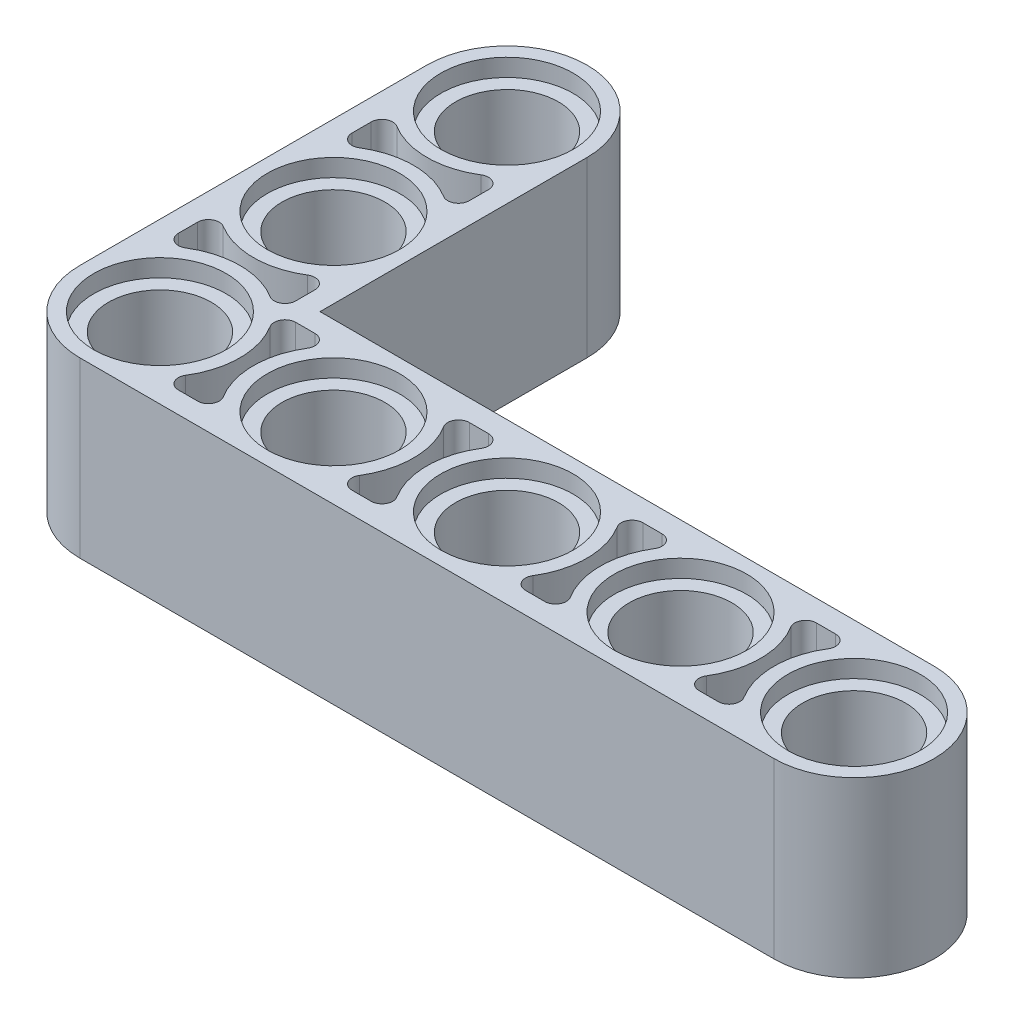
from build123d import *

# Parameters (mm, degrees)
BOSS_EXTRUDE1_DEPTH = 8.065
CUT_EXTRUDE1_DEPTH  = 3
CUT_EXTRUDE2_DEPTH  = 3
CUT_EXTRUDE3_DEPTH  = 3
CUT_EXTRUDE4_DEPTH  = 3
CUT_EXTRUDE5_DEPTH  = 3
CUT_EXTRUDE6_DEPTH  = 3
CUT_EXTRUDE7_START  = -3
CUT_EXTRUDE7_DEPTH  = 3
CUT_EXTRUDE8_START  = -3
CUT_EXTRUDE8_DEPTH  = 3
CUT_EXTRUDE9_START  = -3
CUT_EXTRUDE9_DEPTH  = 3
CUT_EXTRUDE10_START = -3
CUT_EXTRUDE10_DEPTH = 3
CUT_EXTRUDE11_START = -3
CUT_EXTRUDE11_DEPTH = 3
CUT_EXTRUDE12_START = -3
CUT_EXTRUDE12_DEPTH = 3
FILLET1_R           = 3.72


with BuildPart() as part:
    # Sketch1 → Boss-Extrude1 (new body)
    with BuildSketch(Plane(origin=(0, 4.0325, 0), x_dir=(1, 0, 0), z_dir=(0, 1, 0))):
        with BuildLine():
            Line((0, 3.72), (-28.54, 3.72))
            Line((-28.54, 3.72), (-28.54, 16.13))
            ThreePointArc((-28.54, 16.13), (-32.26, 19.85), (-35.98, 16.13))
            Line((-35.98, 16.13), (-35.98, -3.72))
            Line((-35.98, -3.72), (0, -3.72))
            ThreePointArc((0, -3.72), (3.72, 0), (0, 3.72))
        make_face()
    extrude(amount=-BOSS_EXTRUDE1_DEPTH)

    # Sketch2 → Cut-Extrude1 (cut)
    with BuildSketch(Plane(origin=(0, 4.0325, 0), x_dir=(-1, 0, 0), z_dir=(0, 1, 0))):
        with BuildLine():
            Line((3.5855, -2.725441473), (4.4795, -2.725441473))
            ThreePointArc((4.4795, -2.725441473), (4.916443331, -2.468506331), (4.904322275, -1.961763573))
            ThreePointArc((4.904322275, -1.961763573), (4.345, 0), (4.904322275, 1.961763573))
            ThreePointArc((4.904322275, 1.961763573), (4.916443331, 2.468506331), (4.4795, 2.725441473))
            Line((4.4795, 2.725441473), (3.5855, 2.725441473))
            ThreePointArc((3.5855, 2.725441473), (3.148556669, 2.468506331), (3.160677725, 1.961763573))
            ThreePointArc((3.160677725, 1.961763573), (3.72, 0), (3.160677725, -1.961763573))
            ThreePointArc((3.160677725, -1.961763573), (3.148556669, -2.468506331), (3.5855, -2.725441473))
        make_face()
    extrude(amount=-CUT_EXTRUDE1_DEPTH, mode=Mode.SUBTRACT)

    # Sketch3 → Cut-Extrude2 (cut)
    with BuildSketch(Plane(origin=(0, 4.0325, 0), x_dir=(-1, 0, 0), z_dir=(0, 1, 0))):
        with BuildLine():
            Line((11.6505, -2.725441473), (12.5445, -2.725441473))
            ThreePointArc((12.5445, -2.725441473), (12.981443331, -2.468506331), (12.969322275, -1.961763573))
            ThreePointArc((12.969322275, -1.961763573), (12.41, 0), (12.969322275, 1.961763573))
            ThreePointArc((12.969322275, 1.961763573), (12.981443331, 2.468506331), (12.5445, 2.725441473))
            Line((12.5445, 2.725441473), (11.6505, 2.725441473))
            ThreePointArc((11.6505, 2.725441473), (11.213556669, 2.468506331), (11.225677725, 1.961763573))
            ThreePointArc((11.225677725, 1.961763573), (11.785, 0), (11.225677725, -1.961763573))
            ThreePointArc((11.225677725, -1.961763573), (11.213556669, -2.468506331), (11.6505, -2.725441473))
        make_face()
    extrude(amount=-CUT_EXTRUDE2_DEPTH, mode=Mode.SUBTRACT)

    # Sketch4 → Cut-Extrude3 (cut)
    with BuildSketch(Plane(origin=(0, 4.0325, 0), x_dir=(-1, 0, 0), z_dir=(0, 1, 0))):
        with BuildLine():
            Line((19.7155, -2.725441473), (20.6095, -2.725441473))
            ThreePointArc((20.6095, -2.725441473), (21.046443331, -2.468506331), (21.034322275, -1.961763573))
            ThreePointArc((21.034322275, -1.961763573), (20.475, 0), (21.034322275, 1.961763573))
            ThreePointArc((21.034322275, 1.961763573), (21.046443331, 2.468506331), (20.6095, 2.725441473))
            Line((20.6095, 2.725441473), (19.7155, 2.725441473))
            ThreePointArc((19.7155, 2.725441473), (19.278556669, 2.468506331), (19.290677725, 1.961763573))
            ThreePointArc((19.290677725, 1.961763573), (19.85, 0), (19.290677725, -1.961763573))
            ThreePointArc((19.290677725, -1.961763573), (19.278556669, -2.468506331), (19.7155, -2.725441473))
        make_face()
    extrude(amount=-CUT_EXTRUDE3_DEPTH, mode=Mode.SUBTRACT)

    # Sketch5 → Cut-Extrude4 (cut)
    with BuildSketch(Plane(origin=(0, 4.0325, 0), x_dir=(-1, 0, 0), z_dir=(0, 1, 0))):
        with BuildLine():
            Line((27.7805, -2.725441473), (28.6745, -2.725441473))
            ThreePointArc((28.6745, -2.725441473), (29.111443331, -2.468506331), (29.099322275, -1.961763573))
            ThreePointArc((29.099322275, -1.961763573), (28.54, 0), (29.099322275, 1.961763573))
            ThreePointArc((29.099322275, 1.961763573), (29.111443331, 2.468506331), (28.6745, 2.725441473))
            Line((28.6745, 2.725441473), (27.7805, 2.725441473))
            ThreePointArc((27.7805, 2.725441473), (27.343556669, 2.468506331), (27.355677725, 1.961763573))
            ThreePointArc((27.355677725, 1.961763573), (27.915, 0), (27.355677725, -1.961763573))
            ThreePointArc((27.355677725, -1.961763573), (27.343556669, -2.468506331), (27.7805, -2.725441473))
        make_face()
    extrude(amount=-CUT_EXTRUDE4_DEPTH, mode=Mode.SUBTRACT)

    # Sketch6 → Cut-Extrude5 (cut)
    with BuildSketch(Plane(origin=(0, 4.0325, 0), x_dir=(-1, 0, 0), z_dir=(0, 1, 0))):
        with BuildLine():
            Line((29.534558527, -3.5855), (29.534558527, -4.4795))
            ThreePointArc((29.534558527, -4.4795), (29.791493669, -4.916443331), (30.298236427, -4.904322275))
            ThreePointArc((30.298236427, -4.904322275), (32.26, -4.345), (34.221763573, -4.904322275))
            ThreePointArc((34.221763573, -4.904322275), (34.728506331, -4.916443331), (34.985441473, -4.4795))
            Line((34.985441473, -4.4795), (34.985441473, -3.5855))
            ThreePointArc((34.985441473, -3.5855), (34.728506331, -3.148556669), (34.221763573, -3.160677725))
            ThreePointArc((34.221763573, -3.160677725), (32.26, -3.72), (30.298236427, -3.160677725))
            ThreePointArc((30.298236427, -3.160677725), (29.791493669, -3.148556669), (29.534558527, -3.5855))
        make_face()
    extrude(amount=-CUT_EXTRUDE5_DEPTH, mode=Mode.SUBTRACT)

    # Sketch7 → Cut-Extrude6 (cut)
    with BuildSketch(Plane(origin=(0, 4.0325, 0), x_dir=(-1, 0, 0), z_dir=(0, 1, 0))):
        with BuildLine():
            Line((29.534558527, -11.6505), (29.534558527, -12.5445))
            ThreePointArc((29.534558527, -12.5445), (29.791493669, -12.981443331), (30.298236427, -12.969322275))
            ThreePointArc((30.298236427, -12.969322275), (32.26, -12.41), (34.221763573, -12.969322275))
            ThreePointArc((34.221763573, -12.969322275), (34.728506331, -12.981443331), (34.985441473, -12.5445))
            Line((34.985441473, -12.5445), (34.985441473, -11.6505))
            ThreePointArc((34.985441473, -11.6505), (34.728506331, -11.213556669), (34.221763573, -11.225677725))
            ThreePointArc((34.221763573, -11.225677725), (32.26, -11.785), (30.298236427, -11.225677725))
            ThreePointArc((30.298236427, -11.225677725), (29.791493669, -11.213556669), (29.534558527, -11.6505))
        make_face()
    extrude(amount=-CUT_EXTRUDE6_DEPTH, mode=Mode.SUBTRACT)

    # Sketch8 → Cut-Extrude7 (cut)
    with BuildSketch(Plane.XZ.offset(4.0325).offset(CUT_EXTRUDE7_START)):
        with BuildLine():
            Line((-4.4795, -2.725441473), (-3.5855, -2.725441473))
            ThreePointArc((-3.5855, -2.725441473), (-3.148556669, -2.468506331), (-3.160677725, -1.961763573))
            ThreePointArc((-3.160677725, -1.961763573), (-3.72, 0), (-3.160677725, 1.961763573))
            ThreePointArc((-3.160677725, 1.961763573), (-3.148556669, 2.468506331), (-3.5855, 2.725441473))
            Line((-3.5855, 2.725441473), (-4.4795, 2.725441473))
            ThreePointArc((-4.4795, 2.725441473), (-4.916443331, 2.468506331), (-4.904322275, 1.961763573))
            ThreePointArc((-4.904322275, 1.961763573), (-4.345, 0), (-4.904322275, -1.961763573))
            ThreePointArc((-4.904322275, -1.961763573), (-4.916443331, -2.468506331), (-4.4795, -2.725441473))
        make_face()
    extrude(amount=CUT_EXTRUDE7_DEPTH, mode=Mode.SUBTRACT)

    # Sketch9 → Cut-Extrude8 (cut)
    with BuildSketch(Plane.XZ.offset(4.0325).offset(CUT_EXTRUDE8_START)):
        with BuildLine():
            Line((-11.6505, 2.725441473), (-12.5445, 2.725441473))
            ThreePointArc((-12.5445, 2.725441473), (-12.981443331, 2.468506331), (-12.969322275, 1.961763573))
            ThreePointArc((-12.969322275, 1.961763573), (-12.41, 0), (-12.969322275, -1.961763573))
            ThreePointArc((-12.969322275, -1.961763573), (-12.981443331, -2.468506331), (-12.5445, -2.725441473))
            Line((-12.5445, -2.725441473), (-11.6505, -2.725441473))
            ThreePointArc((-11.6505, -2.725441473), (-11.213556669, -2.468506331), (-11.225677725, -1.961763573))
            ThreePointArc((-11.225677725, -1.961763573), (-11.785, 0), (-11.225677725, 1.961763573))
            ThreePointArc((-11.225677725, 1.961763573), (-11.213556669, 2.468506331), (-11.6505, 2.725441473))
        make_face()
    extrude(amount=CUT_EXTRUDE8_DEPTH, mode=Mode.SUBTRACT)

    # Sketch10 → Cut-Extrude9 (cut)
    with BuildSketch(Plane.XZ.offset(4.0325).offset(CUT_EXTRUDE9_START)):
        with BuildLine():
            Line((-20.6095, -2.725441473), (-19.7155, -2.725441473))
            ThreePointArc((-19.7155, -2.725441473), (-19.278556669, -2.468506331), (-19.290677725, -1.961763573))
            ThreePointArc((-19.290677725, -1.961763573), (-19.85, 0), (-19.290677725, 1.961763573))
            ThreePointArc((-19.290677725, 1.961763573), (-19.278556669, 2.468506331), (-19.7155, 2.725441473))
            Line((-19.7155, 2.725441473), (-20.6095, 2.725441473))
            ThreePointArc((-20.6095, 2.725441473), (-21.046443331, 2.468506331), (-21.034322275, 1.961763573))
            ThreePointArc((-21.034322275, 1.961763573), (-20.475, 0), (-21.034322275, -1.961763573))
            ThreePointArc((-21.034322275, -1.961763573), (-21.046443331, -2.468506331), (-20.6095, -2.725441473))
        make_face()
    extrude(amount=CUT_EXTRUDE9_DEPTH, mode=Mode.SUBTRACT)

    # Sketch11 → Cut-Extrude10 (cut)
    with BuildSketch(Plane.XZ.offset(4.0325).offset(CUT_EXTRUDE10_START)):
        with BuildLine():
            Line((-27.7805, 2.725441473), (-28.6745, 2.725441473))
            ThreePointArc((-28.6745, 2.725441473), (-29.111443331, 2.468506331), (-29.099322275, 1.961763573))
            ThreePointArc((-29.099322275, 1.961763573), (-28.54, 0), (-29.099322275, -1.961763573))
            ThreePointArc((-29.099322275, -1.961763573), (-29.111443331, -2.468506331), (-28.6745, -2.725441473))
            Line((-28.6745, -2.725441473), (-27.7805, -2.725441473))
            ThreePointArc((-27.7805, -2.725441473), (-27.343556669, -2.468506331), (-27.355677725, -1.961763573))
            ThreePointArc((-27.355677725, -1.961763573), (-27.915, 0), (-27.355677725, 1.961763573))
            ThreePointArc((-27.355677725, 1.961763573), (-27.343556669, 2.468506331), (-27.7805, 2.725441473))
        make_face()
    extrude(amount=CUT_EXTRUDE10_DEPTH, mode=Mode.SUBTRACT)

    # Sketch12 → Cut-Extrude11 (cut)
    with BuildSketch(Plane.XZ.offset(4.0325).offset(CUT_EXTRUDE11_START)):
        with BuildLine():
            Line((-29.534558527, -4.4795), (-29.534558527, -3.5855))
            ThreePointArc((-29.534558527, -3.5855), (-29.791493669, -3.148556669), (-30.298236427, -3.160677725))
            ThreePointArc((-30.298236427, -3.160677725), (-32.26, -3.72), (-34.221763573, -3.160677725))
            ThreePointArc((-34.221763573, -3.160677725), (-34.728506331, -3.148556669), (-34.985441473, -3.5855))
            Line((-34.985441473, -3.5855), (-34.985441473, -4.4795))
            ThreePointArc((-34.985441473, -4.4795), (-34.728506331, -4.916443331), (-34.221763573, -4.904322275))
            ThreePointArc((-34.221763573, -4.904322275), (-32.26, -4.345), (-30.298236427, -4.904322275))
            ThreePointArc((-30.298236427, -4.904322275), (-29.791493669, -4.916443331), (-29.534558527, -4.4795))
        make_face()
    extrude(amount=CUT_EXTRUDE11_DEPTH, mode=Mode.SUBTRACT)

    # Sketch13 → Cut-Extrude12 (cut)
    with BuildSketch(Plane.XZ.offset(4.0325).offset(CUT_EXTRUDE12_START)):
        with BuildLine():
            Line((-34.985441473, -11.6505), (-34.985441473, -12.5445))
            ThreePointArc((-34.985441473, -12.5445), (-34.728506331, -12.981443331), (-34.221763573, -12.969322275))
            ThreePointArc((-34.221763573, -12.969322275), (-32.26, -12.41), (-30.298236427, -12.969322275))
            ThreePointArc((-30.298236427, -12.969322275), (-29.791493669, -12.981443331), (-29.534558527, -12.5445))
            Line((-29.534558527, -12.5445), (-29.534558527, -11.6505))
            ThreePointArc((-29.534558527, -11.6505), (-29.791493669, -11.213556669), (-30.298236427, -11.225677725))
            ThreePointArc((-30.298236427, -11.225677725), (-32.26, -11.785), (-34.221763573, -11.225677725))
            ThreePointArc((-34.221763573, -11.225677725), (-34.728506331, -11.213556669), (-34.985441473, -11.6505))
        make_face()
    extrude(amount=CUT_EXTRUDE12_DEPTH, mode=Mode.SUBTRACT)

    # Sketch14 → Cut-Revolve1 (revolve, cut)
    with BuildSketch(Plane(origin=(0, 0, 0), x_dir=(-1, 0, 0), z_dir=(0, 0, -1)), mode=Mode.PRIVATE) as cut_revolve1_sk:
        Polygon((-3.075, -4.0325), (0, -4.0325), (0, 4.0325), (-3.075, 4.0325), (-3.075, 3.2175), (-2.39, 3.2175), (-2.39, -3.2175), (-3.075, -3.2175), align=None)
    revolve(cut_revolve1_sk.sketch.rotate(Axis((0, -4.0325, 0), (0, 1, 0)), 270), axis=Axis((0, -4.0325, 0), (0, 1, 0)), mode=Mode.SUBTRACT)

    # Sketch15 → Cut-Revolve2 (revolve, cut)
    with BuildSketch(Plane(origin=(0, 0, 0), x_dir=(-1, 0, 0), z_dir=(0, 0, -1)), mode=Mode.PRIVATE) as cut_revolve2_sk:
        Polygon((4.99, -4.0325), (8.065, -4.0325), (8.065, 4.0325), (4.99, 4.0325), (4.99, 3.2175), (5.675, 3.2175), (5.675, -3.2175), (4.99, -3.2175), align=None)
    revolve(cut_revolve2_sk.sketch.rotate(Axis((-8.065, -4.0325, 0), (0, 1, 0)), 270), axis=Axis((-8.065, -4.0325, 0), (0, 1, 0)), mode=Mode.SUBTRACT)

    # Sketch16 → Cut-Revolve3 (revolve, cut)
    with BuildSketch(Plane(origin=(0, 0, 0), x_dir=(-1, 0, 0), z_dir=(0, 0, -1)), mode=Mode.PRIVATE) as cut_revolve3_sk:
        Polygon((13.055, -4.0325), (16.13, -4.0325), (16.13, 4.0325), (13.055, 4.0325), (13.055, 3.2175), (13.74, 3.2175), (13.74, -3.2175), (13.055, -3.2175), align=None)
    revolve(cut_revolve3_sk.sketch.rotate(Axis((-16.13, -4.0325, 0), (0, 1, 0)), 270), axis=Axis((-16.13, -4.0325, 0), (0, 1, 0)), mode=Mode.SUBTRACT)

    # Sketch17 → Cut-Revolve4 (revolve, cut)
    with BuildSketch(Plane(origin=(0, 0, 0), x_dir=(-1, 0, 0), z_dir=(0, 0, -1)), mode=Mode.PRIVATE) as cut_revolve4_sk:
        Polygon((21.12, -4.0325), (24.195, -4.0325), (24.195, 4.0325), (21.12, 4.0325), (21.12, 3.2175), (21.805, 3.2175), (21.805, -3.2175), (21.12, -3.2175), align=None)
    revolve(cut_revolve4_sk.sketch.rotate(Axis((-24.195, -4.0325, 0), (0, 1, 0)), 270), axis=Axis((-24.195, -4.0325, 0), (0, 1, 0)), mode=Mode.SUBTRACT)

    # Sketch18 → Cut-Revolve5 (revolve, cut)
    with BuildSketch(Plane(origin=(0, 0, 0), x_dir=(-1, 0, 0), z_dir=(0, 0, -1)), mode=Mode.PRIVATE) as cut_revolve5_sk:
        Polygon((29.185, -4.0325), (32.26, -4.0325), (32.26, 4.0325), (29.185, 4.0325), (29.185, 3.2175), (29.87, 3.2175), (29.87, -3.2175), (29.185, -3.2175), align=None)
    revolve(cut_revolve5_sk.sketch.rotate(Axis((-32.26, -4.0325, 0), (0, 1, 0)), 270), axis=Axis((-32.26, -4.0325, 0), (0, 1, 0)), mode=Mode.SUBTRACT)

    # Sketch19 → Cut-Revolve6 (revolve, cut)
    with BuildSketch(Plane(origin=(0, 0, -8.065), x_dir=(-1, 0, 0), z_dir=(0, 0, -1)), mode=Mode.PRIVATE) as cut_revolve6_sk:
        Polygon((29.185, -4.0325), (32.26, -4.0325), (32.26, 4.0325), (29.185, 4.0325), (29.185, 3.2175), (29.87, 3.2175), (29.87, -3.2175), (29.185, -3.2175), align=None)
    revolve(cut_revolve6_sk.sketch.rotate(Axis((-32.26, -4.0325, -8.065), (0, 1, 0)), 270), axis=Axis((-32.26, -4.0325, -8.065), (0, 1, 0)), mode=Mode.SUBTRACT)

    # Sketch20 → Cut-Revolve7 (revolve, cut)
    with BuildSketch(Plane(origin=(0, 0, -16.13), x_dir=(-1, 0, 0), z_dir=(0, 0, -1)), mode=Mode.PRIVATE) as cut_revolve7_sk:
        Polygon((29.185, -4.0325), (32.26, -4.0325), (32.26, 4.0325), (29.185, 4.0325), (29.185, 3.2175), (29.87, 3.2175), (29.87, -3.2175), (29.185, -3.2175), align=None)
    revolve(cut_revolve7_sk.sketch.rotate(Axis((-32.26, -4.0325, -16.13), (0, 1, 0)), 270), axis=Axis((-32.26, -4.0325, -16.13), (0, 1, 0)), mode=Mode.SUBTRACT)

    # Fillet1
    fillet1_edges = [part.edges().sort_by_distance(p)[0] for p in [
        (-35.98, 0, 3.72),
    ]]
    fillet(fillet1_edges, radius=FILLET1_R)


solid = part.part
